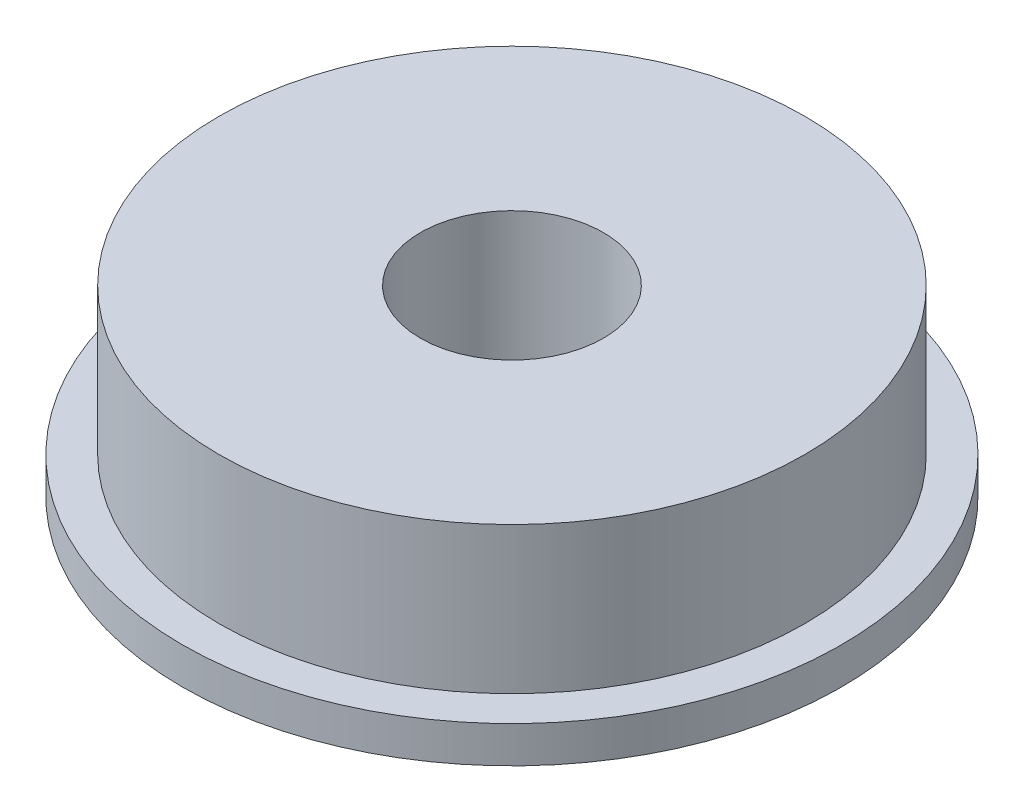
from build123d import *

# Parameters (mm, degrees)
CROQUIS1_R              = 9
CROQUIS1_R_2            = 8
SALIENTE_EXTRUIR1_DEPTH = 1
CROQUIS1_3_R            = 8
CROQUIS1_3_R_2          = 2.5
SALIENTE_EXTRUIR2_DEPTH = 5


with BuildPart() as part:
    # Croquis1 → Saliente-Extruir1 (new body)
    with BuildSketch(Plane(origin=(0, 0, 0), x_dir=(1, 0, 0), z_dir=(0, 1, 0))):
        Circle(CROQUIS1_R)
        Circle(CROQUIS1_R_2, mode=Mode.SUBTRACT)
    extrude(amount=SALIENTE_EXTRUIR1_DEPTH)

    # Croquis1<3> → Saliente-Extruir2 (add)
    with BuildSketch(Plane(origin=(0, 0, 0), x_dir=(1, 0, 0), z_dir=(0, 1, 0))):
        Circle(CROQUIS1_3_R)
        Circle(CROQUIS1_3_R_2, mode=Mode.SUBTRACT)
    extrude(amount=SALIENTE_EXTRUIR2_DEPTH)


solid = part.part
